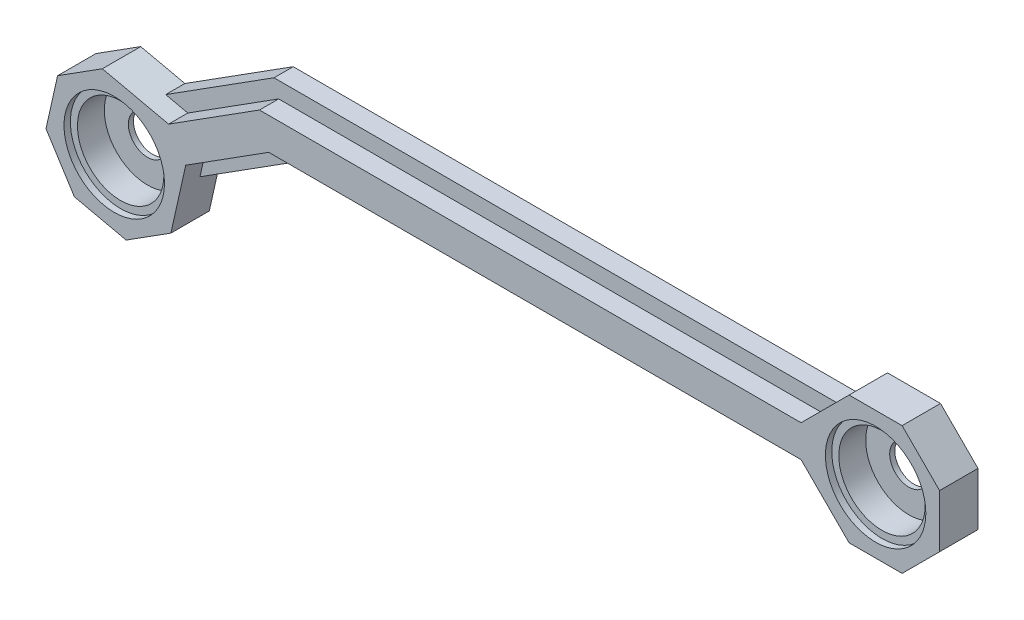
from build123d import *

# Parameters (mm, degrees)
SKETCH1_R           = 3
BOSS_EXTRUDE1_DEPTH = 6
BOSS_EXTRUDE2_DEPTH = 3
SKETCH3_R           = 7.85
CUT_EXTRUDE1_DEPTH  = 1
SKETCH4_R           = 6.75
CUT_EXTRUDE2_DEPTH  = 5.2
SKETCH5_W           = 10.298947731
SKETCH5_H           = 6.677630872
BOSS_EXTRUDE3_DEPTH = 0.8
SKETCH6_R           = 3
CUT_EXTRUDE3_DEPTH  = 0.8
BOSS_EXTRUDE5_START = -6
SKETCH7_R           = 9.071835919
SKETCH7_R_2         = 3
SKETCH7_R_3         = 8.53010645
BOSS_EXTRUDE5_DEPTH = 6
SKETCH8_R           = 7.85
CUT_EXTRUDE4_DEPTH  = 1
SKETCH9_R           = 6.75
CUT_EXTRUDE5_DEPTH  = 5.2
BOSS_EXTRUDE6_DEPTH = 3
CUT_EXTRUDE10_DEPTH = 3


with BuildPart() as part:
    # Sketch1 → Boss-Extrude1 (new body)
    with BuildSketch(Plane.XY):
        Polygon((4.142135624, 10), (-4.142135624, 10), (-11.642135624, 2.5), (-96.276080567, 2.5), (-110.474741511, -6.507268438), (-120.82549793, -4.191703376), (-127.82091412, -8.629417024), (-129.629482932, -16.713860663), (-125.191769284, -23.709276854), (-117.107325644, -25.517845665), (-110.111909454, -21.080132017), (-107.796344392, -10.729375598), (-94.823919433, -2.5), (-11.642135624, -2.5), (-4.142135624, -10), (4.142135624, -10), (10, -4.142135624), (10, 4.142135624), align=None)
        with Locations((-118.966411787, -14.85477452)):
            Circle(SKETCH1_R, mode=Mode.SUBTRACT)
        with Locations((-0.876614201, 0)):
            Circle(SKETCH1_R, mode=Mode.SUBTRACT)
    extrude(amount=-BOSS_EXTRUDE1_DEPTH)

    # Sketch2 → Boss-Extrude2 (add)
    with BuildSketch(Plane.XY):
        Polygon((-113.924993651, -5.735413417), (-110.474741511, -6.507268438), (-96.276080567, 2.5), (-11.642135624, 2.5), (-9.142135624, 5), (-97.002161134, 5), align=None)
        Polygon((-108.568199413, -14.179627738), (-107.796344392, -10.729375598), (-94.823919433, -2.5), (-11.642135624, -2.5), (-9.142135624, -5), (-94.097838866, -5), align=None)
    extrude(amount=-BOSS_EXTRUDE2_DEPTH)

    # Sketch3 → Cut-Extrude1 (cut)
    with BuildSketch(Plane(origin=(0, 0, -6), x_dir=(-1, 0, 0), z_dir=(0, 0, -1))):
        Circle(SKETCH3_R)
        with Locations((118.966411787, -14.85477452)):
            Circle(SKETCH3_R)
    extrude(amount=-CUT_EXTRUDE1_DEPTH, mode=Mode.SUBTRACT)

    # Sketch4 → Cut-Extrude2 (cut)
    with BuildSketch(Plane(origin=(0, 0, -6), x_dir=(-1, 0, 0), z_dir=(0, 0, -1))):
        Circle(SKETCH4_R)
        with Locations((118.966411787, -14.85477452)):
            Circle(SKETCH4_R)
    extrude(amount=-CUT_EXTRUDE2_DEPTH, mode=Mode.SUBTRACT)

    # Sketch5 → Boss-Extrude3 (add)
    with BuildSketch(Plane.XY):
        with Locations((-0.876614202, 0)):
            Rectangle(SKETCH5_W, SKETCH5_H)
    extrude(amount=-BOSS_EXTRUDE3_DEPTH)

    # Sketch6 → Cut-Extrude3 (cut)
    with BuildSketch(Plane.XY):
        Circle(SKETCH6_R)
    extrude(amount=-CUT_EXTRUDE3_DEPTH, mode=Mode.SUBTRACT)

    # Sketch7 → Boss-Extrude5 (add)
    # profile 1 of 2: a face of its own
    with BuildSketch(Plane(origin=(0, 0, -6), x_dir=(-1, 0, 0), z_dir=(0, 0, -1)).offset(BOSS_EXTRUDE5_START)):
        Circle(SKETCH7_R)
        with Locations(Location((0, 0, 0), (0, 0, 180))):
            Circle(SKETCH7_R_2, mode=Mode.SUBTRACT)
    # profile 2 of 2: a face of its own
    with BuildSketch(Plane(origin=(0, 0, -6), x_dir=(-1, 0, 0), z_dir=(0, 0, -1)).offset(BOSS_EXTRUDE5_START)):
        with Locations((118.966411787, -14.85477452)):
            Circle(SKETCH7_R_3)
        with Locations(Location((118.966411787, -14.85477452, 0), (0, 0, 180))):
            Circle(SKETCH7_R_2, mode=Mode.SUBTRACT)
    extrude(amount=BOSS_EXTRUDE5_DEPTH)

    # Sketch8 → Cut-Extrude4 (cut)
    with BuildSketch(Plane.XY):
        with Locations((-118.966411787, -14.85477452)):
            Circle(SKETCH8_R)
        Circle(SKETCH8_R)
    extrude(amount=-CUT_EXTRUDE4_DEPTH, mode=Mode.SUBTRACT)

    # Sketch9 → Cut-Extrude5 (cut)
    with BuildSketch(Plane.XY):
        with Locations((-118.966411787, -14.85477452)):
            Circle(SKETCH9_R)
        Circle(SKETCH9_R)
    extrude(amount=-CUT_EXTRUDE5_DEPTH, mode=Mode.SUBTRACT)

    # Sketch10 → Boss-Extrude6 (add)
    with BuildSketch(Plane(origin=(0, 0, -3), x_dir=(-1, 0, 0), z_dir=(0, 0, -1))):
        Polygon((9.142135624, -5), (11.642135624, -2.5), (94.823919433, -2.5), (107.796344392, -10.729375598), (108.568199413, -14.179627738), (94.097838866, -5), align=None)
        Polygon((9.142135624, 5), (11.642135624, 2.5), (96.276080567, 2.5), (110.474741511, -6.507268438), (113.924993651, -5.735413417), (97.002161134, 5), align=None)
    extrude(amount=BOSS_EXTRUDE6_DEPTH)

    # Sketch11 → Cut-Extrude10 (cut)
    with BuildSketch(Plane.XY):
        Polygon((-9.142135624, 5), (-97.002161134, 5), (-113.924993651, -5.735413417), (-110.474741511, -6.507268438), (-96.276080567, 2.5), (-11.642135624, 2.5), align=None)
        Polygon((-11.642135624, -2.5), (-94.823919433, -2.5), (-107.796344392, -10.729375598), (-108.568199413, -14.179627738), (-94.097838866, -5), (-9.142135624, -5), align=None)
    extrude(amount=-CUT_EXTRUDE10_DEPTH, mode=Mode.SUBTRACT)


solid = part.part
